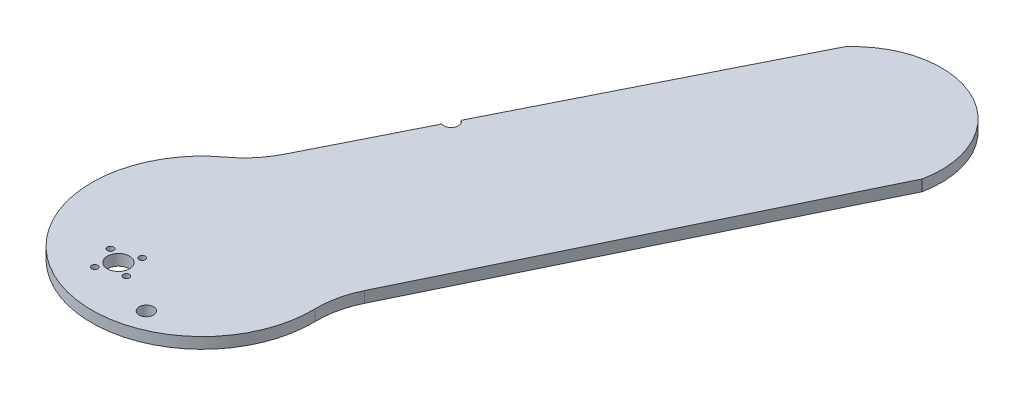
from build123d import *

# Parameters (mm, degrees)
EXTRUDE_1_DEPTH     = 5
SKETCH_2_R          = 3.25
CUT_EXTRUDE_1_DEPTH = 19
SKETCH_3_R          = 1.4
SKETCH_3_R_2        = 5
CUT_EXTRUDE_3_DEPTH = 16.3


with BuildPart() as part:
    # 草图1 → 凸台-拉伸1 (new body)
    with BuildSketch(Plane(origin=(0, 0, 0), x_dir=(1, 0, 0), z_dir=(0, 1, 0))):
        with BuildLine():
            Line((-17.564991461, 54.578581424), (67.059916818, 223.42374787))
            ThreePointArc((67.059916818, 223.42374787), (114.908570146, 233.021342221), (136.424164559, 189.21852679))
            Line((136.424164559, 189.21852679), (53.992344711, 19.291894357))
            ThreePointArc((53.992344711, 19.291894357), (50.907753569, 10.392547603), (49.989622613, 1.018641763))
            ThreePointArc((49.989622613, 1.018641763), (-22.113685441, -44.844006469), (-29.624956892, 40.278554209))
            ThreePointArc((-29.624956892, 40.278554209), (-22.747275075, 46.713658557), (-17.564991461, 54.578581424))
        make_face()
    extrude(amount=EXTRUDE_1_DEPTH)

    # 草图2 → 切除-拉伸1 (cut)
    with BuildSketch(Plane.XZ):
        with Locations(Location((12.651398898, 37.946569093, 0), (0, 0, 270))):
            Circle(SKETCH_2_R)
        with Locations((81.596428252, -36.190269417)):
            Circle(SKETCH_2_R)
        with Locations((7.459589742, -105.135298771)):
            Circle(SKETCH_2_R)
        with Locations((-61.485439612, -30.998460261)):
            Circle(SKETCH_2_R)
    extrude(amount=-CUT_EXTRUDE_1_DEPTH, mode=Mode.SUBTRACT)

    # 草图3 → 切除-拉伸3 (cut)
    with BuildSketch(Plane.XZ):
        with Locations(Location((-16.224862373, 32.454617251, 0), (0, 0, 270))):
            Circle(SKETCH_3_R)
        with Locations(Location((-19.803218354, 21.72170672, 0), (0, 0, 270))):
            Circle(SKETCH_3_R)
        with Locations(Location((-12.647585098, 25.298983995, 0), (0, 0, 270))):
            Circle(SKETCH_3_R_2)
        with Locations(Location((-5.491951842, 28.876261271, 0), (0, 0, 270))):
            Circle(SKETCH_3_R)
        with Locations(Location((-9.070307822, 18.143350739, 0), (0, 0, 270))):
            Circle(SKETCH_3_R)
    extrude(amount=-CUT_EXTRUDE_3_DEPTH, mode=Mode.SUBTRACT)


solid = part.part
